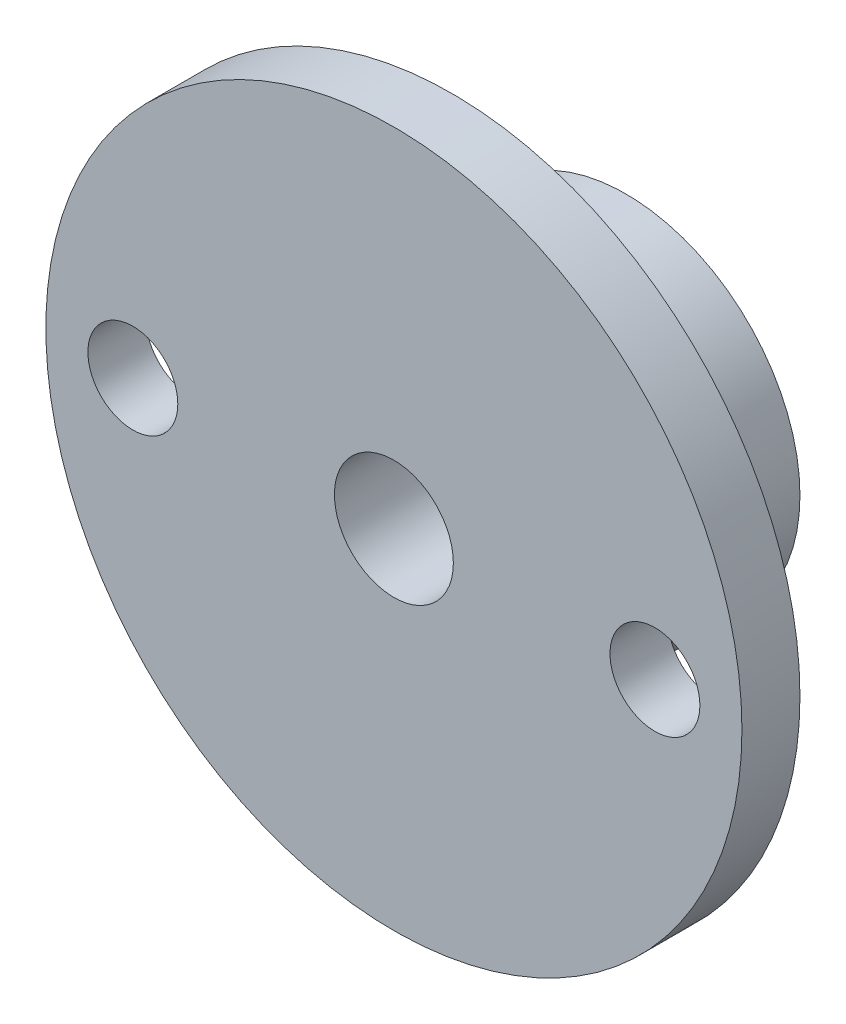
from build123d import *

# Parameters (mm, degrees)
ESQUISSE1_R             = 6
EXTRUSION1_DEPTH        = 6
ESQUISSE2_R             = 12
EXTRUSION2_DEPTH        = 2
ESQUISSE3_R             = 2.05
ENL_V_MAT_EXTRU_1_DEPTH = 19.761663039
ESQUISSE4_R             = 1.55
ENL_V_MAT_EXTRU_2_DEPTH = 19.761663039
ESQUISSE5_R             = 1.5
ENL_V_MAT_EXTRU_3_DEPTH = 10


with BuildPart() as part:
    # Esquisse1 → Extrusion1 (new body)
    with BuildSketch(Plane.XY):
        Circle(ESQUISSE1_R)
    extrude(amount=EXTRUSION1_DEPTH)

    # Esquisse2 → Extrusion2 (add)
    with BuildSketch(Plane.XY.offset(6)):
        Circle(ESQUISSE2_R)
    extrude(amount=EXTRUSION2_DEPTH)

    # Esquisse3 → Enlèv. mat.-Extru.1 (cut, through all)
    with BuildSketch(Plane.XY.offset(8)):
        Circle(ESQUISSE3_R)
    extrude(amount=-ENL_V_MAT_EXTRU_1_DEPTH, mode=Mode.SUBTRACT)

    # Esquisse4 → Enlèv. mat.-Extru.2 (cut, through all)
    with BuildSketch(Plane.XY.offset(8)):
        with Locations((-9, 0)):
            Circle(ESQUISSE4_R)
        with Locations((9, 0)):
            Circle(ESQUISSE4_R)
    extrude(amount=-ENL_V_MAT_EXTRU_2_DEPTH, mode=Mode.SUBTRACT)

    # Esquisse5 → Enlèv. mat.-Extru.3 (cut)
    with BuildSketch(Plane(origin=(0, 0, 0), x_dir=(1, 0, 0), z_dir=(0, 1, 0))):
        with Locations((0, -3)):
            Circle(ESQUISSE5_R)
    extrude(amount=-ENL_V_MAT_EXTRU_3_DEPTH, mode=Mode.SUBTRACT)


solid = part.part
